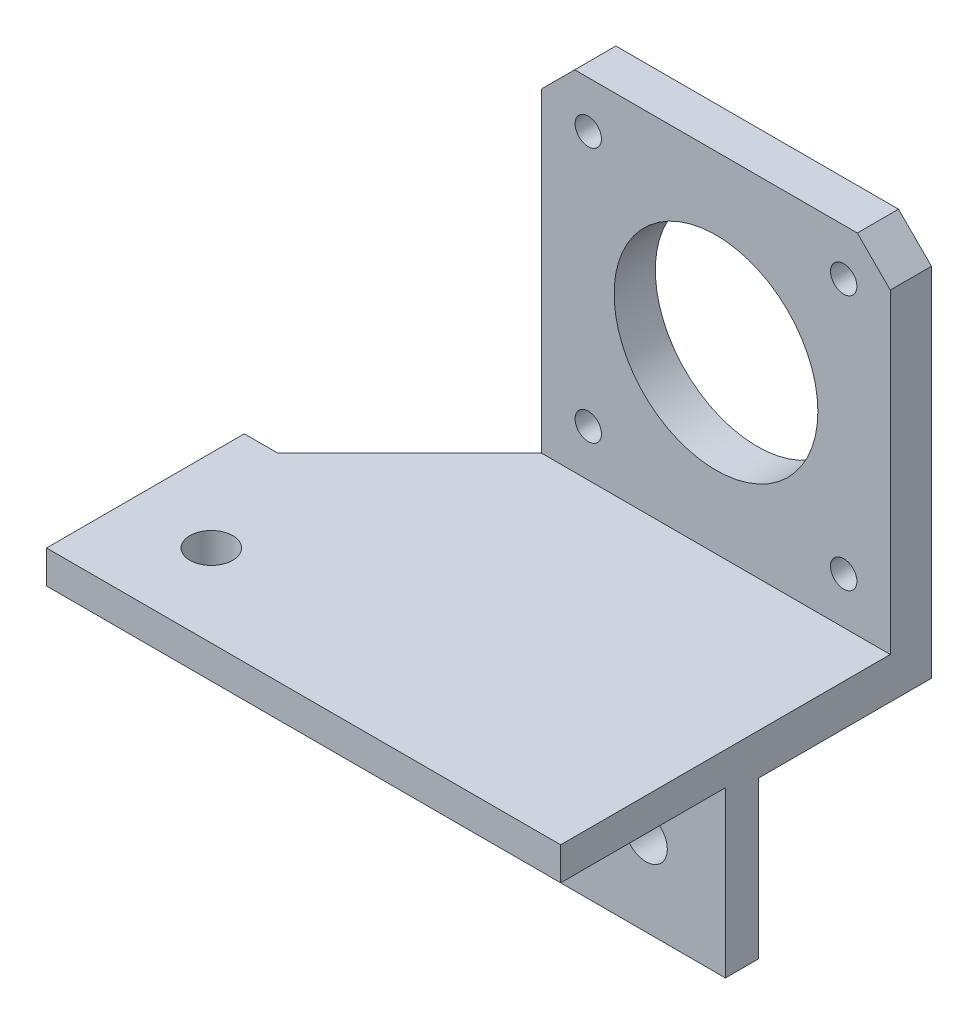
from build123d import *

# Parameters (mm, degrees)
SKICA1_W                 = 62.391596743
SKICA1_H                 = 24
P_IDAT_VYSUNUT_M1_DEPTH  = 4
SKICA2_W                 = 42.3
SKICA2_H                 = 5
P_IDAT_VYSUNUT_M2_DEPTH  = 16
SKICA3_R                 = 1.6
SKICA3_R_2               = 12.36434098
P_IDAT_VYSUNUT_M5_DEPTH  = 5
ZKOSEN_1_SIZE            = 16
SKICA4_R                 = 2.6
ODEBRAT_VYSUNUT_M1_DEPTH = 4
SKICA5_W                 = 62.391596743
SKICA5_H                 = 4
P_IDAT_VYSUNUT_M6_DEPTH  = 20
SKICA6_R                 = 2.6
ODEBRAT_VYSUNUT_M2_DEPTH = 4
SKICA7_W                 = 52.547851764
SKICA7_H                 = 73.400173893
ODEBRAT_VYSUNUT_M3_DEPTH = 80


with BuildPart() as part:
    # Skica1 → Přidat vysunutím1 (new body)
    with BuildSketch(Plane.XY):
        with Locations((-71.195798372, -0.971059771)):
            Rectangle(SKICA1_W, SKICA1_H)
    extrude(amount=P_IDAT_VYSUNUT_M1_DEPTH)

    # Skica2 → Přidat vysunutím2 (add)
    with BuildSketch(Plane.XY.offset(4)):
        with Locations((-61.15, 8.528940229)):
            Rectangle(SKICA2_W, SKICA2_H)
    extrude(amount=P_IDAT_VYSUNUT_M2_DEPTH)

    # Skica3 → Přidat vysunutím5 (add)
    with BuildSketch(Plane.XY.offset(20)):
        Polygon((-40, 6.028940229), (-82.3, 6.028940229), (-82.3, 49.328940229), (-78.3, 53.328940229), (-44, 53.328940229), (-40, 49.328940229), align=None)
        with Locations((-45.65, 47.678940229)):
            Circle(SKICA3_R, mode=Mode.SUBTRACT)
        with Locations((-76.65, 47.678940229)):
            Circle(SKICA3_R, mode=Mode.SUBTRACT)
        with Locations((-76.65, 16.678940229)):
            Circle(SKICA3_R, mode=Mode.SUBTRACT)
        with Locations((-45.65, 16.678940229)):
            Circle(SKICA3_R, mode=Mode.SUBTRACT)
        with Locations((-61.15, 32.178940229)):
            Circle(SKICA3_R_2, mode=Mode.SUBTRACT)
    extrude(amount=P_IDAT_VYSUNUT_M5_DEPTH)

    # Zkosení1
    zkosen_1_edges = [part.edges().sort_by_distance(p)[0] for p in [
        (-82.3, 8.528940229, 4),
    ]]
    chamfer(zkosen_1_edges, length=ZKOSEN_1_SIZE)

    # Skica4 → Odebrat vysunutím1 (cut)
    with BuildSketch(Plane.XY.offset(4)):
        with Locations((-89.655606689, -2.971059771)):
            Circle(SKICA4_R)
        with Locations((-69.655606689, -2.971059771)):
            Circle(SKICA4_R)
        with Locations((-49.655606689, -2.971059771)):
            Circle(SKICA4_R)
    extrude(amount=-ODEBRAT_VYSUNUT_M1_DEPTH, mode=Mode.SUBTRACT)

    # Skica5 → Přidat vysunutím6 (add)
    with BuildSketch(Plane(origin=(0, 0, 0), x_dir=(-1, 0, 0), z_dir=(0, 0, -1))):
        with Locations((71.195798372, 9.028940229)):
            Rectangle(SKICA5_W, SKICA5_H)
    extrude(amount=P_IDAT_VYSUNUT_M6_DEPTH)

    # Skica6 → Odebrat vysunutím2 (cut)
    with BuildSketch(Plane(origin=(0, 11.028940229, 0), x_dir=(1, 0, 0), z_dir=(0, 1, 0))):
        with Locations(Location((-92.391596743, 10, 0), (0, 0, 270))):
            Circle(SKICA6_R)
    extrude(amount=-ODEBRAT_VYSUNUT_M2_DEPTH, mode=Mode.SUBTRACT)


with BuildPart() as body_2:
    # Zrcadlit2: mirrored copy
    add(part.part.mirror(Plane(origin=(-350, -6.109059771, -20), x_dir=(1, 0, 0), z_dir=(0, 0, 1))))


with BuildPart() as part_1:
    add(part.part)

    # Skica7 → Odebrat vysunutím3 (cut)
    with BuildSketch(Plane.ZY.offset(102.391596743)):
        with Locations((6.273925882, 18.093708017)):
            Rectangle(SKICA7_W, SKICA7_H)
    extrude(amount=-ODEBRAT_VYSUNUT_M3_DEPTH, mode=Mode.SUBTRACT)


solid = body_2.part
